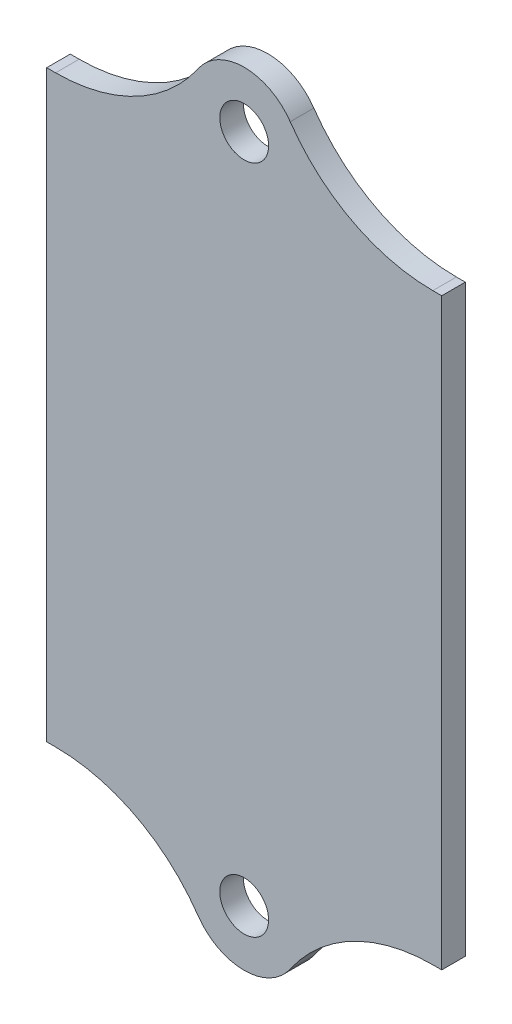
from build123d import *

# Parameters (mm, degrees)
BOSS_EXTRUDE1_DEPTH = 1.5
SKETCH2_R           = 1.55
CUT_EXTRUDE1_DEPTH  = 54.49517282


with BuildPart() as part:
    # Sketch1 → Boss-Extrude1 (new body)
    with BuildSketch(Plane.XY):
        with BuildLine():
            Line((-10.351321581, 8), (-10.351321581, 45.1))
            Line((-10.351321581, 45.1), (-9.925677234, 45.1))
            Line((-9.925677234, 45.1), (-9.786312195, 45.1))
            ThreePointArc((-9.786312195, 45.1), (-4.668121471, 46.363259082), (-0.725494549, 49.862886598))
            ThreePointArc((-0.725494549, 49.862886598), (2.198678419, 51.4), (5.122851386, 49.862886598))
            ThreePointArc((5.122851386, 49.862886598), (9.065478308, 46.363259082), (14.183669032, 45.1))
            Line((14.183669032, 45.1), (14.323034072, 45.1))
            Line((14.323034072, 45.1), (14.748678419, 45.1))
            Line((14.748678419, 45.1), (14.748678419, 8))
            Line((14.748678419, 8), (14.183669032, 8))
            ThreePointArc((14.183669032, 8), (9.065478308, 6.736740918), (5.122851386, 3.237113402))
            ThreePointArc((5.122851386, 3.237113402), (2.198678419, 1.7), (-0.725494549, 3.237113402))
            ThreePointArc((-0.725494549, 3.237113402), (-4.668121471, 6.736740918), (-9.786312195, 8))
            Line((-9.786312195, 8), (-10.351321581, 8))
        make_face()
    extrude(amount=BOSS_EXTRUDE1_DEPTH)

    # Sketch2 → Cut-Extrude1 (cut, through all)
    with BuildSketch(Plane.XY.offset(1.5)):
        with Locations((2.198678419, 47.85)):
            Circle(SKETCH2_R)
        with Locations((2.198678419, 5.25)):
            Circle(SKETCH2_R)
    extrude(amount=-CUT_EXTRUDE1_DEPTH, mode=Mode.SUBTRACT)


solid = part.part
